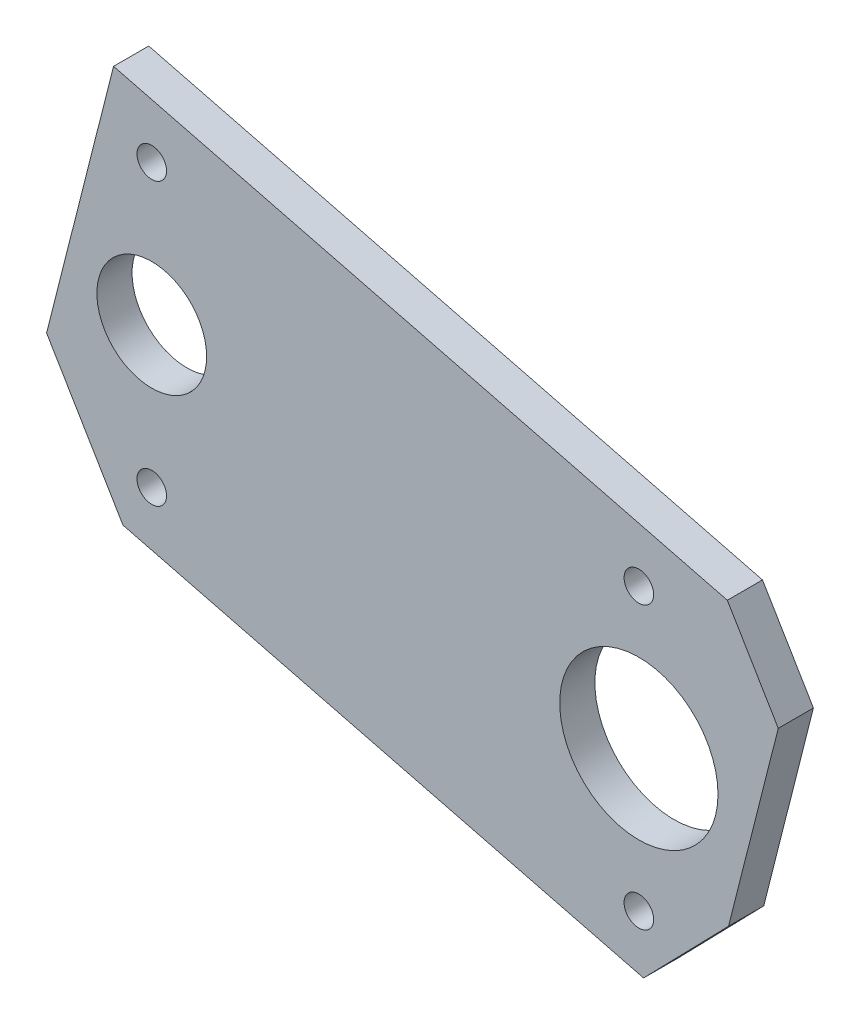
from build123d import *

# Parameters (mm, degrees)
SKETCH1_R           = 9.906
SKETCH1_R_2         = 14.2875
SKETCH1_R_3         = 2.667
BOSS_EXTRUDE1_DEPTH = 6.35


with BuildPart() as part:
    # Sketch1 → Boss-Extrude1 (new body)
    with BuildSketch(Plane.XY):
        Polygon((12.15597468, 91.000063132), (122.95536215, 62.928979497), (132.147395909, 47.498927153), (123.172465774, 12.073976179), (107.832275805, -3.691447117), (13.850085892, 20.118990589), (0.062035253, 43.264069106), align=None)
        with Locations((19.05, 54.027523873)):
            Circle(SKETCH1_R, mode=Mode.SUBTRACT)
        with Locations((106.981625, 31.75)):
            Circle(SKETCH1_R_2, mode=Mode.SUBTRACT)
        with Locations((106.981625, 57.15)):
            Circle(SKETCH1_R_3, mode=Mode.SUBTRACT)
        with Locations((106.981625, 6.35)):
            Circle(SKETCH1_R_3, mode=Mode.SUBTRACT)
        with Locations((19.05, 79.427523873)):
            Circle(SKETCH1_R_3, mode=Mode.SUBTRACT)
        with Locations((19.05, 28.627523873)):
            Circle(SKETCH1_R_3, mode=Mode.SUBTRACT)
    extrude(amount=BOSS_EXTRUDE1_DEPTH)


solid = part.part
